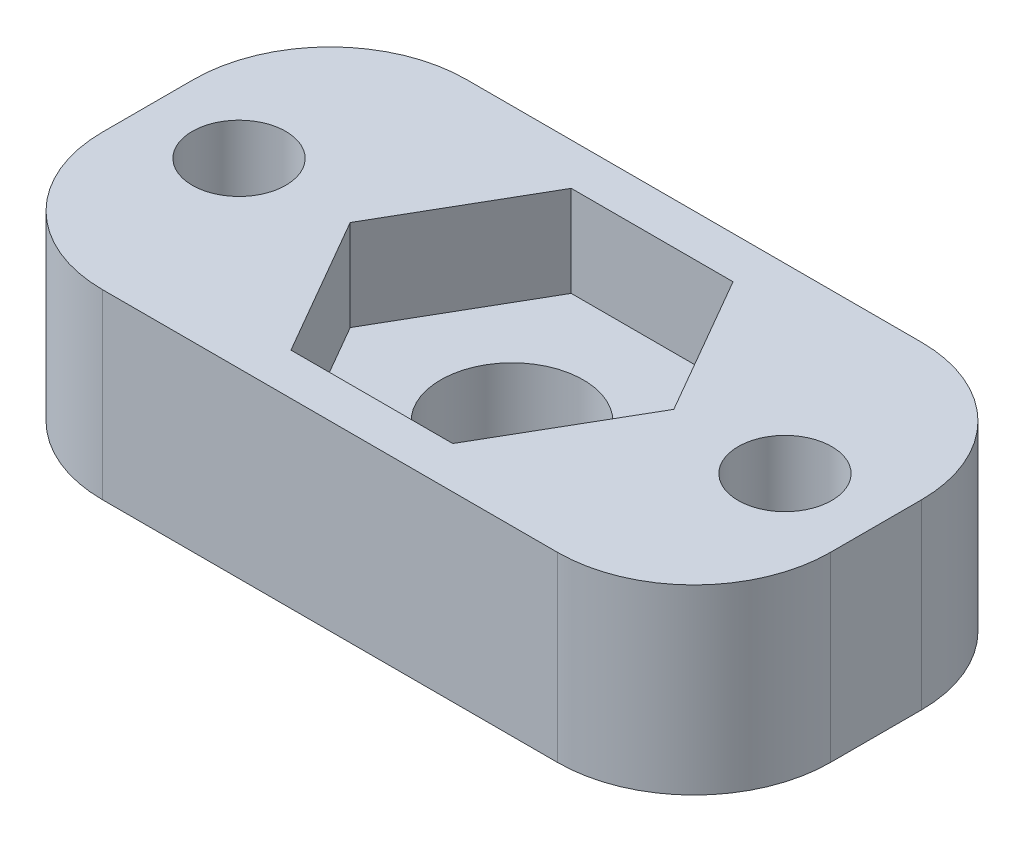
from build123d import *

# Parameters (mm, degrees)
SKETCH1_W           = 25.4
SKETCH1_H           = 12.7
SKETCH1_R           = 1.63195
SKETCH1_R_2         = 2.4892
BOSS_EXTRUDE1_DEPTH = 3.175
SKETCH1_3_W         = 25.4
SKETCH1_3_H         = 12.7
SKETCH1_3_R         = 1.63195
BOSS_EXTRUDE2_DEPTH = 6.35
FILLET1_R           = 4.7625


with BuildPart() as part:
    # Sketch1 → Boss-Extrude1 (new body)
    # profile 1 of 2: a face of its own
    with BuildSketch(Plane(origin=(0, 0, 0), x_dir=(1, 0, 0), z_dir=(0, 1, 0))):
        Rectangle(SKETCH1_W, SKETCH1_H)
        with Locations(Location((9.525, 0, 0), (0, 0, 270))):
            Circle(SKETCH1_R, mode=Mode.SUBTRACT)
        with Locations(Location((-9.525, 0, 0), (0, 0, 270))):
            Circle(SKETCH1_R, mode=Mode.SUBTRACT)
        Polygon((2.822954141, -4.8895), (5.645908282, 0), (2.822954141, 4.8895), (-2.822954141, 4.8895), (-5.645908282, 0), (-2.822954141, -4.8895), align=None, mode=Mode.SUBTRACT)
    # profile 2 of 2: a face of its own
    with BuildSketch(Plane(origin=(0, 0, 0), x_dir=(1, 0, 0), z_dir=(0, 1, 0))):
        Polygon((-2.822954141, -4.8895), (2.822954141, -4.8895), (5.645908282, 0), (2.822954141, 4.8895), (-2.822954141, 4.8895), (-5.645908282, 0), align=None)
        with Locations(Location((0, 0, 0), (0, 0, 270))):
            Circle(SKETCH1_R_2, mode=Mode.SUBTRACT)
    extrude(amount=BOSS_EXTRUDE1_DEPTH)

    # Sketch1<3> → Boss-Extrude2 (add)
    with BuildSketch(Plane(origin=(0, 0, 0), x_dir=(1, 0, 0), z_dir=(0, 1, 0))):
        Rectangle(SKETCH1_3_W, SKETCH1_3_H)
        with Locations(Location((9.525, 0, 0), (0, 0, 270))):
            Circle(SKETCH1_3_R, mode=Mode.SUBTRACT)
        with Locations(Location((-9.525, 0, 0), (0, 0, 270))):
            Circle(SKETCH1_3_R, mode=Mode.SUBTRACT)
        Polygon((2.822954141, -4.8895), (5.645908282, 0), (2.822954141, 4.8895), (-2.822954141, 4.8895), (-5.645908282, 0), (-2.822954141, -4.8895), align=None, mode=Mode.SUBTRACT)
    extrude(amount=BOSS_EXTRUDE2_DEPTH)

    # Fillet1
    fillet1_edges = [part.edges().sort_by_distance(p)[0] for p in [
        (12.7, 3.175, 6.35),
        (-12.7, 3.175, 6.35),
        (-12.7, 3.175, -6.35),
        (12.7, 3.175, -6.35),
    ]]
    fillet(fillet1_edges, radius=FILLET1_R)


solid = part.part
